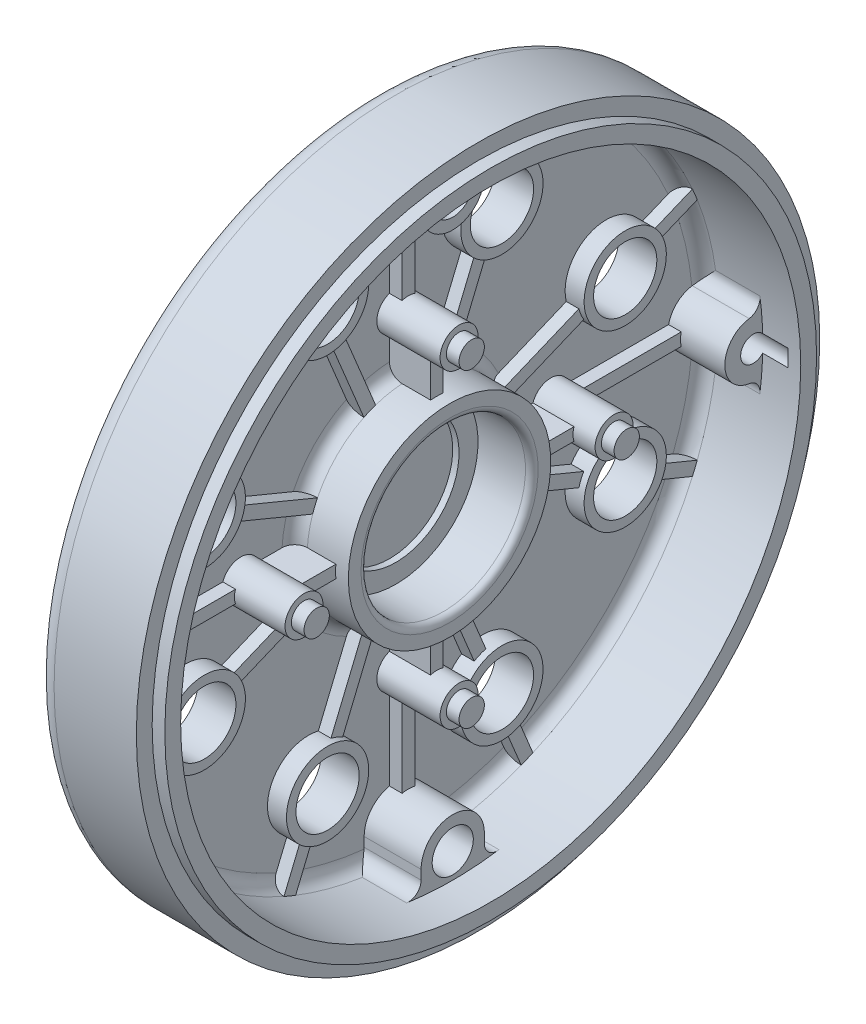
from build123d import *

# Parameters (mm, degrees)
EXTRUSION1_REACH             = 79.305
ESQUISSE3_R                  = 3.25
ENL_V_MAT_EXTRU_1_DEPTH      = 78.30459243
R_P_TITION_CIRCULAIRE1_COUNT = 2
EXTRUSION2_START             = -9.000004
EXTRUSION2_DEPTH             = 9.000004
ESQUISSE7_W                  = 2
ESQUISSE7_H                  = 16
R_P_TITION_CIRCULAIRE2_COUNT = 2
NERVURE1_REACH               = 79.466
ESQUISSE9_R                  = 6.5
EXTRUSION3_DEPTH             = 3
ESQUISSE10_R                 = 5
ENL_V_MAT_EXTRU_2_DEPTH      = 78.30459243
R_P_TITION_CIRCULAIRE3_COUNT = 8
NERVURE2_REACH               = 79.466
ESQUISSE12_WALLS_W           = 2
ESQUISSE12_WALLS_H           = 180.932243394
ESQUISSE12_WALLS_W_2         = 183.932243394
ESQUISSE12_WALLS_H_2         = 2
ESQUISSE13_R                 = 3
EXTRUSION4_DEPTH             = 10
ESQUISSE14_R                 = 2
EXTRUSION5_DEPTH             = 2
R_P_TITION_CIRCULAIRE4_COUNT = 4
NERVURE3_REACH               = 78.956
ESQUISSE15_WALLS_W           = 2
ESQUISSE15_WALLS_H           = 161.412312838
ESQUISSE15_WALLS_W_2         = 161.412312838
ESQUISSE15_WALLS_H_2         = 2


with BuildPart() as part:
    # Esquisse1 → Révolution1 (revolve)
    with BuildSketch(Plane.XY, mode=Mode.PRIVATE) as r_volution1_sk:
        with BuildLine():
            Line((0, 0), (0, 51))
            ThreePointArc((0, 51), (0.878679656, 53.121320344), (3, 54))
            Line((3, 54), (16, 54))
            Line((16, 54), (16, 51.5))
            Line((16, 51.5), (18, 51.5))
            Line((18, 51.5), (18, 49))
            Line((18, 49), (5, 49))
            ThreePointArc((5, 49), (3.585786438, 48.414213562), (3, 47))
            Line((3, 47), (3, 18))
            ThreePointArc((3, 18), (3.585786438, 16.585786438), (5, 16))
            Line((5, 16), (11.5, 16))
            Line((11.5, 16), (11.5, 14))
            ThreePointArc((11.5, 14), (11.207106781, 13.292893219), (10.5, 13))
            Line((10.5, 13), (3, 13))
            Line((3, 13), (3, 10))
            Line((3, 10), (2, 10))
            Line((2, 10), (2, 0))
            Line((2, 0), (0, 0))
        make_face()
    revolve(r_volution1_sk.sketch.rotate(Axis((0, 0, 0), (1, 0, 0)), 90), axis=Axis((0, 0, 0), (1, 0, 0)))

    # Extrusion1: up to this face of the body (flat: up to its plane)
    extrusion1_end = Plane(part.part.faces().sort_by_distance((3, 0, -45.670639251))[0])
    # Esquisse2 → Extrusion1 (add, up to the picked face)
    with BuildSketch(Plane(origin=(12, 0, 0), x_dir=(0, 0, -1), z_dir=(1, 0, 0)), mode=Mode.PRIVATE) as extrusion1_sk1:
        with BuildLine():
            Line((-5, 45), (-5, 46.475800154))
            ThreePointArc((-5, 46.475800154), (-5.695343854, 47.991673612), (-7.29787234, 48.453493778))
            ThreePointArc((-7.29787234, 48.453493778), (0, 49), (7.29787234, 48.453493778))
            ThreePointArc((7.29787234, 48.453493778), (5.695343854, 47.991673612), (5, 46.475800154))
            Line((5, 46.475800154), (5, 45))
            ThreePointArc((5, 45), (0, 40), (-5, 45))
        make_face()
    extrusion1_tool1 = split(extrude(extrusion1_sk1.sketch, amount=-EXTRUSION1_REACH, mode=Mode.PRIVATE), bisect_by=extrusion1_end, keep=Keep.BOTH, mode=Mode.PRIVATE)
    extrusion1 = extrusion1_tool1.solids().sort_by(Axis((12, 45.008794, 0), (-1, 0, 0)))[0]
    add(extrusion1)

    # Esquisse3 → Enlèv. mat.-Extru.1 (cut, through all)
    with BuildSketch(Plane(origin=(12, 0, 0), x_dir=(0, 0, -1), z_dir=(1, 0, 0))):
        with Locations((0, 45)):
            Circle(ESQUISSE3_R)
    enl_v_mat_extru_1 = extrude(amount=-ENL_V_MAT_EXTRU_1_DEPTH, mode=Mode.SUBTRACT)

    # Répétition circulaire1: Extrusion1, Enlèv. mat.-Extru.1 ×2 about axis
    r_p_tition_circulaire1_axis = Axis((0, 0, 0), (1, 0, 0))
    add([extrusion1.rotate(r_p_tition_circulaire1_axis, i * 360 / R_P_TITION_CIRCULAIRE1_COUNT) for i in range(1, R_P_TITION_CIRCULAIRE1_COUNT)])
    add([enl_v_mat_extru_1.rotate(r_p_tition_circulaire1_axis, i * 360 / R_P_TITION_CIRCULAIRE1_COUNT) for i in range(1, R_P_TITION_CIRCULAIRE1_COUNT)], mode=Mode.SUBTRACT)

    # Esquisse4 → Extrusion2 (add)
    with BuildSketch(Plane(origin=(12, 0, 0), x_dir=(0, 0, -1), z_dir=(1, 0, 0)).offset(EXTRUSION2_START)):
        with BuildLine():
            ThreePointArc((-46.847773279, -4.452482488), (-43, 0), (-46.847773279, 4.452482488))
            ThreePointArc((-46.847773279, 4.452482488), (-48.157249917, 5.230504314), (-48.539081747, 6.70503864))
            ThreePointArc((-48.539081747, 6.70503864), (-49, 0), (-48.539081747, -6.70503864))
            ThreePointArc((-48.539081747, -6.70503864), (-48.157249917, -5.230504314), (-46.847773279, -4.452482488))
        make_face()
    extrusion2 = extrude(amount=EXTRUSION2_DEPTH)

    # Esquisse7 → Trou taraudé M51 (revolve, cut)
    with BuildSketch(Plane(origin=(16, 0, 47.5), x_dir=(0, 0, -1), z_dir=(0, 1, 0))):
        with Locations((1, 8)):
            Rectangle(ESQUISSE7_W, ESQUISSE7_H)
    trou_taraud_m51 = revolve(axis=Axis((22.35, 0, 47.5), (-1, 0, 0)), mode=Mode.SUBTRACT)

    # Répétition circulaire2: Extrusion2, Trou taraudé M51 ×2 about axis
    r_p_tition_circulaire2_axis = Axis((0, 0, 0), (1, 0, 0))
    add([extrusion2.rotate(r_p_tition_circulaire2_axis, i * 360 / R_P_TITION_CIRCULAIRE2_COUNT) for i in range(1, R_P_TITION_CIRCULAIRE2_COUNT)])
    add([trou_taraud_m51.rotate(r_p_tition_circulaire2_axis, i * 360 / R_P_TITION_CIRCULAIRE2_COUNT) for i in range(1, R_P_TITION_CIRCULAIRE2_COUNT)], mode=Mode.SUBTRACT)

    # Esquisse11 walls → Nervure1 (add, up to next)
    with BuildSketch(Plane(origin=(5, 0, 0), x_dir=(0, 0, -1), z_dir=(1, 0, 0)), mode=Mode.PRIVATE) as nervure1_sk1:
        Polygon((-49.703052494, 117.380657492), (22.980870325, -58.093854744), (24.82862939, -57.328487879), (-47.855293429, 118.146024357), align=None)
    nervure1_tool1 = extrude(nervure1_sk1.sketch, amount=-NERVURE1_REACH, mode=Mode.PRIVATE) - part.part
    # Esquisse11 walls → Nervure1 (add, up to next)
    with BuildSketch(Plane(origin=(5, 0, 0), x_dir=(0, 0, -1), z_dir=(1, 0, 0)), mode=Mode.PRIVATE) as nervure1_sk2:
        Polygon((47.855293429, 118.146024357), (-24.82862939, -57.328487879), (-22.980870325, -58.093854744), (49.703052494, 117.380657492), align=None)
    nervure1_tool2 = extrude(nervure1_sk2.sketch, amount=-NERVURE1_REACH, mode=Mode.PRIVATE) - part.part
    # Esquisse11 walls → Nervure1 (add, up to next)
    with BuildSketch(Plane(origin=(5, 0, 0), x_dir=(0, 0, -1), z_dir=(1, 0, 0)), mode=Mode.PRIVATE) as nervure1_sk3:
        Polygon((117.380657492, 49.703052494), (-58.093854744, -22.980870325), (-57.328487879, -24.82862939), (118.146024357, 47.855293429), align=None)
    nervure1_tool3 = extrude(nervure1_sk3.sketch, amount=-NERVURE1_REACH, mode=Mode.PRIVATE) - part.part
    # Esquisse11 walls → Nervure1 (add, up to next)
    with BuildSketch(Plane(origin=(5, 0, 0), x_dir=(0, 0, -1), z_dir=(1, 0, 0)), mode=Mode.PRIVATE) as nervure1_sk4:
        Polygon((118.146024357, -47.855293429), (-57.328487879, 24.82862939), (-58.093854744, 22.980870325), (117.380657492, -49.703052494), align=None)
    nervure1_tool4 = extrude(nervure1_sk4.sketch, amount=-NERVURE1_REACH, mode=Mode.PRIVATE) - part.part
    # Esquisse11 walls → Nervure1 (add, up to next)
    with BuildSketch(Plane(origin=(5, 0, 0), x_dir=(0, 0, -1), z_dir=(1, 0, 0)), mode=Mode.PRIVATE) as nervure1_sk5:
        Polygon((49.703052494, -117.380657492), (-22.980870325, 58.093854744), (-24.82862939, 57.328487879), (47.855293429, -118.146024357), align=None)
    nervure1_tool5 = extrude(nervure1_sk5.sketch, amount=-NERVURE1_REACH, mode=Mode.PRIVATE) - part.part
    # Esquisse11 walls → Nervure1 (add, up to next)
    with BuildSketch(Plane(origin=(5, 0, 0), x_dir=(0, 0, -1), z_dir=(1, 0, 0)), mode=Mode.PRIVATE) as nervure1_sk6:
        Polygon((-47.855293429, -118.146024357), (24.82862939, 57.328487879), (22.980870325, 58.093854744), (-49.703052494, -117.380657492), align=None)
    nervure1_tool6 = extrude(nervure1_sk6.sketch, amount=-NERVURE1_REACH, mode=Mode.PRIVATE) - part.part
    # Esquisse11 walls → Nervure1 (add, up to next)
    with BuildSketch(Plane(origin=(5, 0, 0), x_dir=(0, 0, -1), z_dir=(1, 0, 0)), mode=Mode.PRIVATE) as nervure1_sk7:
        Polygon((-117.380657492, -49.703052494), (58.093854744, 22.980870325), (57.328487879, 24.82862939), (-118.146024357, -47.855293429), align=None)
    nervure1_tool7 = extrude(nervure1_sk7.sketch, amount=-NERVURE1_REACH, mode=Mode.PRIVATE) - part.part
    # Esquisse11 walls → Nervure1 (add, up to next)
    with BuildSketch(Plane(origin=(5, 0, 0), x_dir=(0, 0, -1), z_dir=(1, 0, 0)), mode=Mode.PRIVATE) as nervure1_sk8:
        Polygon((-118.146024357, 47.855293429), (57.328487879, -24.82862939), (58.093854744, -22.980870325), (-117.380657492, 49.703052494), align=None)
    nervure1_tool8 = extrude(nervure1_sk8.sketch, amount=-NERVURE1_REACH, mode=Mode.PRIVATE) - part.part
    add(nervure1_tool1.solids().sort_by_distance((5, 30.026084807, 12.437211552))[0])
    add(nervure1_tool2.solids().sort_by_distance((5, 30.026084807, -12.437211552))[0])
    add(nervure1_tool3.solids().sort_by_distance((5, 12.437211552, -30.026084807))[0])
    add(nervure1_tool4.solids().sort_by_distance((5, -12.437211552, -30.026084807))[0])
    add(nervure1_tool5.solids().sort_by_distance((5, -30.026084807, -12.437211552))[0])
    add(nervure1_tool6.solids().sort_by_distance((5, -30.026084807, 12.437211552))[0])
    add(nervure1_tool7.solids().sort_by_distance((5, -12.437211552, 30.026084807))[0])
    add(nervure1_tool8.solids().sort_by_distance((5, 12.437211552, 30.026084807))[0])

    # Esquisse9 → Extrusion3 (add)
    with BuildSketch(Plane(origin=(3, 0, 0), x_dir=(0, 0, -1), z_dir=(1, 0, 0))):
        with Locations(Location((-13.776603565, 33.25966317, 0), (0, 0, 121.349883098))):
            Circle(ESQUISSE9_R)
    extrusion3 = extrude(amount=EXTRUSION3_DEPTH)

    # Esquisse10 → Enlèv. mat.-Extru.2 (cut, through all)
    with BuildSketch(Plane(origin=(6, 0, 0), x_dir=(0, 0, -1), z_dir=(1, 0, 0))):
        with Locations((-13.776603565, 33.25966317)):
            Circle(ESQUISSE10_R)
    enl_v_mat_extru_2 = extrude(amount=-ENL_V_MAT_EXTRU_2_DEPTH, mode=Mode.SUBTRACT)

    # Répétition circulaire3: Extrusion3, Enlèv. mat.-Extru.2 ×8 about axis
    r_p_tition_circulaire3_axis = Axis((0, 0, 0), (1, 0, 0))
    add([extrusion3.rotate(r_p_tition_circulaire3_axis, i * 360 / R_P_TITION_CIRCULAIRE3_COUNT) for i in range(1, R_P_TITION_CIRCULAIRE3_COUNT)])
    add([enl_v_mat_extru_2.rotate(r_p_tition_circulaire3_axis, i * 360 / R_P_TITION_CIRCULAIRE3_COUNT) for i in range(1, R_P_TITION_CIRCULAIRE3_COUNT)], mode=Mode.SUBTRACT)

    # Esquisse12 walls → Nervure2 (add, up to next)
    with BuildSketch(Plane(origin=(5, 0, 0), x_dir=(0, 0, -1), z_dir=(1, 0, 0)), mode=Mode.PRIVATE) as nervure2_sk1:
        with Locations((0, 28)):
            Rectangle(ESQUISSE12_WALLS_W, ESQUISSE12_WALLS_H)
    nervure2_tool1 = extrude(nervure2_sk1.sketch, amount=-NERVURE2_REACH, mode=Mode.PRIVATE) - part.part
    # Esquisse12 walls → Nervure2 (add, up to next)
    with BuildSketch(Plane(origin=(5, 0, 0), x_dir=(0, 0, -1), z_dir=(1, 0, 0)), mode=Mode.PRIVATE) as nervure2_sk2:
        with Locations((-29.5, 0)):
            Rectangle(ESQUISSE12_WALLS_W_2, ESQUISSE12_WALLS_H_2)
    nervure2_tool2 = extrude(nervure2_sk2.sketch, amount=-NERVURE2_REACH, mode=Mode.PRIVATE) - part.part
    # Esquisse12 walls → Nervure2 (add, up to next)
    with BuildSketch(Plane(origin=(5, 0, 0), x_dir=(0, 0, -1), z_dir=(1, 0, 0)), mode=Mode.PRIVATE) as nervure2_sk3:
        with Locations((0, -28)):
            Rectangle(ESQUISSE12_WALLS_W, ESQUISSE12_WALLS_H)
    nervure2_tool3 = extrude(nervure2_sk3.sketch, amount=-NERVURE2_REACH, mode=Mode.PRIVATE) - part.part
    # Esquisse12 walls → Nervure2 (add, up to next)
    with BuildSketch(Plane(origin=(5, 0, 0), x_dir=(0, 0, -1), z_dir=(1, 0, 0)), mode=Mode.PRIVATE) as nervure2_sk4:
        with Locations((29.5, 0)):
            Rectangle(ESQUISSE12_WALLS_W_2, ESQUISSE12_WALLS_H_2)
    nervure2_tool4 = extrude(nervure2_sk4.sketch, amount=-NERVURE2_REACH, mode=Mode.PRIVATE) - part.part
    add(nervure2_tool1.solids().sort_by_distance((5, 28, 0))[0])
    add(nervure2_tool2.solids().sort_by_distance((5, 0, 29.5))[0])
    add(nervure2_tool3.solids().sort_by_distance((5, -28, 0))[0])
    add(nervure2_tool4.solids().sort_by_distance((5, 0, -29.5))[0])

    # Esquisse13 → Extrusion4 (add)
    with BuildSketch(Plane(origin=(3, 0, 0), x_dir=(0, 0, -1), z_dir=(1, 0, 0))):
        with Locations(Location((0, 24.5, 0), (0, 0, 109.471220634))):
            Circle(ESQUISSE13_R)
    extrusion4 = extrude(amount=EXTRUSION4_DEPTH)

    # Esquisse14 → Extrusion5 (add)
    with BuildSketch(Plane(origin=(13, 0, 0), x_dir=(0, 0, -1), z_dir=(1, 0, 0))):
        with Locations((0, 24.5)):
            Circle(ESQUISSE14_R)
    extrusion5 = extrude(amount=EXTRUSION5_DEPTH)

    # Répétition circulaire4: Extrusion4, Extrusion5 ×4 about axis
    r_p_tition_circulaire4_axis = Axis((0, 0, 0), (1, 0, 0))
    add([extrusion4.rotate(r_p_tition_circulaire4_axis, i * 360 / R_P_TITION_CIRCULAIRE4_COUNT) for i in range(1, R_P_TITION_CIRCULAIRE4_COUNT)])
    add([extrusion5.rotate(r_p_tition_circulaire4_axis, i * 360 / R_P_TITION_CIRCULAIRE4_COUNT) for i in range(1, R_P_TITION_CIRCULAIRE4_COUNT)])

    # Esquisse15 walls → Nervure3 (add, up to next)
    with BuildSketch(Plane(origin=(9.5, 0, 0), x_dir=(0, 0, -1), z_dir=(1, 0, 0)), mode=Mode.PRIVATE) as nervure3_sk1:
        with Locations((0, 18.75)):
            Rectangle(ESQUISSE15_WALLS_W, ESQUISSE15_WALLS_H)
    nervure3_tool1 = extrude(nervure3_sk1.sketch, amount=-NERVURE3_REACH, mode=Mode.PRIVATE) - part.part
    # Esquisse15 walls → Nervure3 (add, up to next)
    with BuildSketch(Plane(origin=(9.5, 0, 0), x_dir=(0, 0, -1), z_dir=(1, 0, 0)), mode=Mode.PRIVATE) as nervure3_sk2:
        with Locations((-18.75, 0)):
            Rectangle(ESQUISSE15_WALLS_W_2, ESQUISSE15_WALLS_H_2)
    nervure3_tool2 = extrude(nervure3_sk2.sketch, amount=-NERVURE3_REACH, mode=Mode.PRIVATE) - part.part
    # Esquisse15 walls → Nervure3 (add, up to next)
    with BuildSketch(Plane(origin=(9.5, 0, 0), x_dir=(0, 0, -1), z_dir=(1, 0, 0)), mode=Mode.PRIVATE) as nervure3_sk3:
        with Locations((0, -18.75)):
            Rectangle(ESQUISSE15_WALLS_W, ESQUISSE15_WALLS_H)
    nervure3_tool3 = extrude(nervure3_sk3.sketch, amount=-NERVURE3_REACH, mode=Mode.PRIVATE) - part.part
    # Esquisse15 walls → Nervure3 (add, up to next)
    with BuildSketch(Plane(origin=(9.5, 0, 0), x_dir=(0, 0, -1), z_dir=(1, 0, 0)), mode=Mode.PRIVATE) as nervure3_sk4:
        with Locations((18.75, 0)):
            Rectangle(ESQUISSE15_WALLS_W_2, ESQUISSE15_WALLS_H_2)
    nervure3_tool4 = extrude(nervure3_sk4.sketch, amount=-NERVURE3_REACH, mode=Mode.PRIVATE) - part.part
    add(nervure3_tool1.solids().sort_by_distance((9.5, 18.75, 0))[0])
    add(nervure3_tool2.solids().sort_by_distance((9.5, 0, 18.75))[0])
    add(nervure3_tool3.solids().sort_by_distance((9.5, -18.75, 0))[0])
    add(nervure3_tool4.solids().sort_by_distance((9.5, 0, -18.75))[0])


solid = part.part
